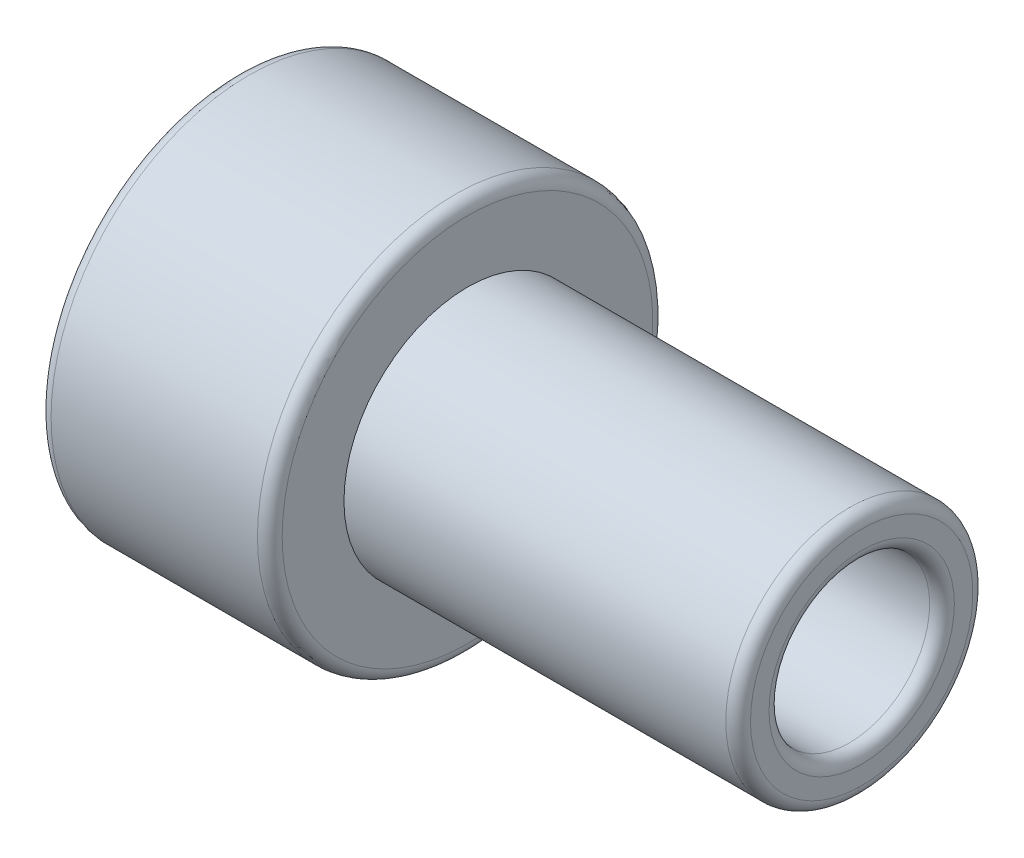
from build123d import *

# Parameters (mm, degrees)
CUT_EXTRUDE1_DEPTH      = 19
CUT_EXTRUDE1_DEPTH_BACK = 19
SKETCH2_R               = 3.25
FILLET1_R               = 0.5


with BuildPart() as part:
    # Sketch1 → Revolve1 (revolve)
    with BuildSketch(Plane.XY, mode=Mode.PRIVATE) as revolve1_sk:
        Polygon((-14, 0), (11.3, 0), (11.3, 5), (-4.65, 5), (-4.65, 8), (-14, 8), align=None)
    revolve(revolve1_sk.sketch.rotate(Axis((-1.174323487, 0, 0), (1, 0, 0)), 90), axis=Axis((-1.174323487, 0, 0), (1, 0, 0)))

    # Sketch2 → Cut-Extrude1 (cut, two sides: drawn at the far end of the back side and taken through both)
    with BuildSketch(Plane(origin=(0, 0, 0), x_dir=(0, 0, -1), z_dir=(1, 0, 0)).offset(-CUT_EXTRUDE1_DEPTH_BACK)):
        Circle(SKETCH2_R)
    extrude(amount=CUT_EXTRUDE1_DEPTH + CUT_EXTRUDE1_DEPTH_BACK, mode=Mode.SUBTRACT)

    # Fillet1
    fillet1_edges = [part.edges().sort_by_distance(p)[0] for p in [
        (-14, 0, 3.25),
        (11.3, 0, 3.25),
        (-14, 0, -8),
        (-4.65, 0, -8),
        (11.3, 0, -5),
    ]]
    fillet(fillet1_edges, radius=FILLET1_R)


solid = part.part
